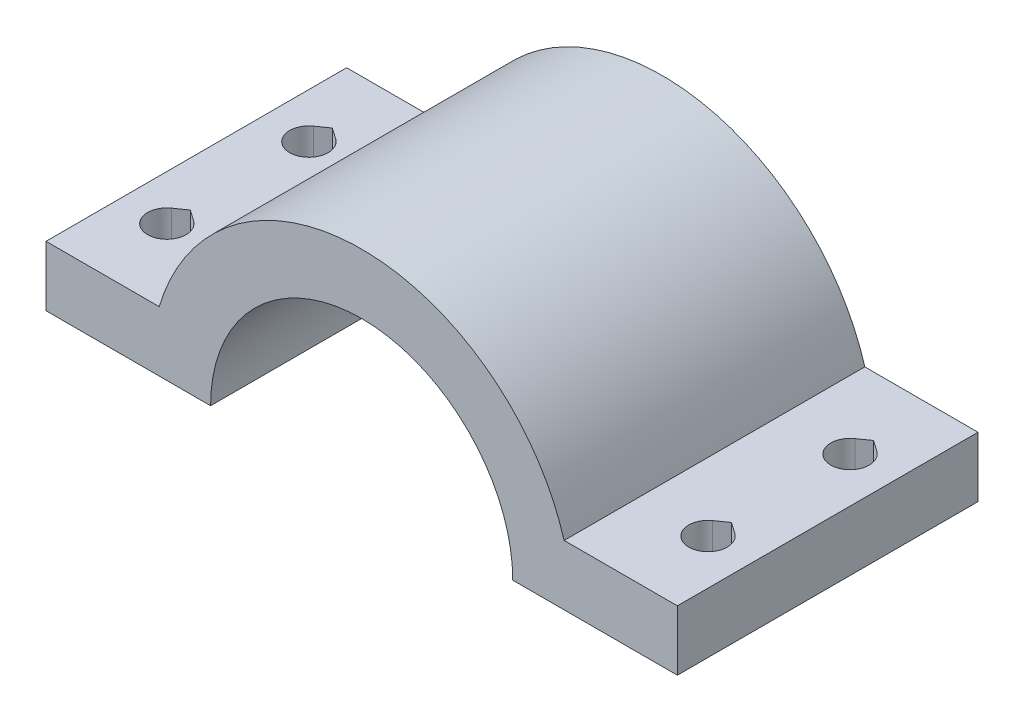
from build123d import *

# Parameters (mm, degrees)
BOSS_EXTRUDE1_DEPTH      = 25.4
SKETCH3_R                = 1.625000052
CUT_EXTRUDE1_HOLES_DEPTH = 39.978915227


with BuildPart() as part:
    # Sketch2 → Boss-Extrude1 (new body)
    with BuildSketch(Plane.XY):
        with BuildLine():
            Line((-26.67, 0), (-17.8435, 0))
            ThreePointArc((-17.8435, 0), (-17.657932489, 2.566692903), (-17.105089659, 5.08))
            Line((-17.105089659, 5.08), (-17.8435, 5.08))
            Line((-17.8435, 5.08), (-26.67, 5.08))
            Line((-26.67, 5.08), (-26.67, 0))
        make_face()
        with BuildLine():
            Line((-17.8435, 0), (-12.7635, 0))
            ThreePointArc((-12.7635, 0), (-12.497093116, 2.594146471), (-11.708993648, 5.08))
            Line((-11.708993648, 5.08), (-17.105089659, 5.08))
            ThreePointArc((-17.105089659, 5.08), (-17.657932489, 2.566692903), (-17.8435, 0))
        make_face()
        with BuildLine():
            Line((-17.105089659, 5.08), (-11.708993648, 5.08))
            ThreePointArc((-11.708993648, 5.08), (0, 12.7635), (11.708993648, 5.08))
            Line((11.708993648, 5.08), (17.105089659, 5.08))
            ThreePointArc((17.105089659, 5.08), (0, 17.8435), (-17.105089659, 5.08))
        make_face()
        with BuildLine():
            ThreePointArc((11.708993648, 5.08), (12.497093116, 2.594146471), (12.7635, 0))
            Line((12.7635, 0), (17.8435, 0))
            ThreePointArc((17.8435, 0), (17.657932489, 2.566692903), (17.105089659, 5.08))
            Line((17.105089659, 5.08), (11.708993648, 5.08))
        make_face()
        with BuildLine():
            ThreePointArc((17.105089659, 5.08), (17.657932489, 2.566692903), (17.8435, 0))
            Line((17.8435, 0), (26.67, 0))
            Line((26.67, 0), (26.67, 5.08))
            Line((26.67, 5.08), (17.8435, 5.08))
            Line((17.8435, 5.08), (17.105089659, 5.08))
        make_face()
    extrude(amount=BOSS_EXTRUDE1_DEPTH)

    # Sketch3 → Cut-Extrude1 Holes (cut, through all)
    with BuildSketch(Plane(origin=(0, 5.08, 0), x_dir=(1, 0, 0), z_dir=(0, 1, 0))):
        with Locations((-22.86, -6.99999997)):
            Circle(SKETCH3_R)
        with BuildLine():
            Line((-22.86, -5.0162412), (-23.792061739, -5.668877855))
            ThreePointArc((-23.792061739, -5.668877855), (-22.86, -5.374999918), (-21.927938261, -5.668877855))
            Line((-21.927938261, -5.668877855), (-22.86, -5.0162412))
        make_face()
        with Locations((-22.86, -18.999999846)):
            Circle(SKETCH3_R)
        with BuildLine():
            Line((-21.927938261, -17.668877731), (-22.86, -17.016241076))
            Line((-22.86, -17.016241076), (-23.792061739, -17.668877731))
            ThreePointArc((-23.792061739, -17.668877731), (-22.86, -17.374999794), (-21.927938261, -17.668877731))
        make_face()
        with Locations((22.86, -18.999999846)):
            Circle(SKETCH3_R)
        with BuildLine():
            Line((23.792061739, -17.668877731), (22.86, -17.016241076))
            Line((22.86, -17.016241076), (21.927938261, -17.668877731))
            ThreePointArc((21.927938261, -17.668877731), (22.86, -17.374999794), (23.792061739, -17.668877731))
        make_face()
        with Locations((22.86, -6.99999997)):
            Circle(SKETCH3_R)
        with BuildLine():
            Line((23.792061739, -5.668877855), (22.86, -5.0162412))
            Line((22.86, -5.0162412), (21.927938261, -5.668877855))
            ThreePointArc((21.927938261, -5.668877855), (22.86, -5.374999918), (23.792061739, -5.668877855))
        make_face()
    extrude(amount=-CUT_EXTRUDE1_HOLES_DEPTH, mode=Mode.SUBTRACT)


solid = part.part
